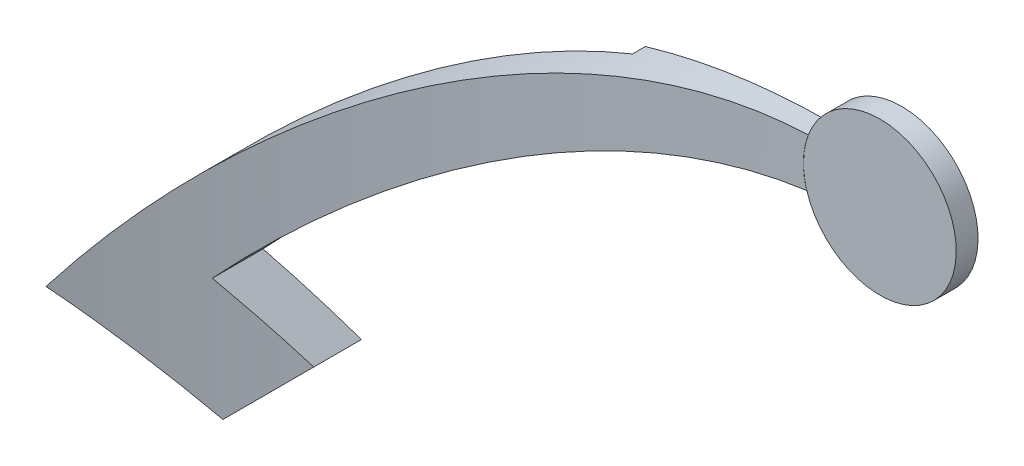
from build123d import *

# Parameters (mm, degrees)
BOSS_EXTRU_2_DEPTH           = 2
BOSS_EXTRU_3_DEPTH           = 45
ENL_V_MAT_EXTRU_3_DEPTH      = 5
ENL_V_MAT_EXTRU_3_DEPTH_BACK = 81.143689392
ENL_V_MAT_EXTRU_4_DEPTH      = 70.76004634


with BuildPart() as part:
    # Esquisse3 → Boss.-Extru.2 (new body)
    with BuildSketch(Plane.XY):
        with BuildLine():
            ThreePointArc((7, 0), (1.246257582, 6.888166813), (-6.556240583, 2.452694319))
            ThreePointArc((-6.556240583, 2.452694319), (-6.99644453, 0.22307834), (-6.699170831, -2.030051767))
            ThreePointArc((-6.699170831, -2.030051767), (1.026110175, -6.924384298), (7, 0))
        make_face()
    extrude(amount=BOSS_EXTRU_2_DEPTH)

    # Esquisse3<3> → Boss.-Extru.3 (add)
    with BuildSketch(Plane.XY):
        with BuildLine():
            ThreePointArc((-6.556240583, 2.452694319), (-35.156121343, -4.82839961), (-56.806558544, -24.883974331))
            Line((-56.806558544, -24.883974331), (-47.470277823, -34.220255052))
            Line((-47.470277823, -34.220255052), (-42.209094679, -28.959071907))
            Line((-42.209094679, -28.959071907), (-48.061618993, -23.106547593))
            ThreePointArc((-48.061618993, -23.106547593), (-29.360618565, -8.682127194), (-6.699170831, -2.030051767))
            ThreePointArc((-6.699170831, -2.030051767), (-6.99644453, 0.22307834), (-6.556240583, 2.452694319))
        make_face()
    extrude(amount=BOSS_EXTRU_3_DEPTH)

    # Esquisse4 → Enlèv. mat.-Extru.3 (cut, two sides: drawn at the far end of the back side and taken through both)
    with BuildSketch(Plane(origin=(0, 0, 0), x_dir=(1, 0, 0), z_dir=(0, 1, 0)).offset(-ENL_V_MAT_EXTRU_3_DEPTH_BACK)):
        with BuildLine():
            Line((-6.556240583, -21.643777245), (-6.556240583, -2))
            ThreePointArc((-6.556240583, -2), (-33.331448935, -7.600933328), (-56.806558544, -21.643777245))
            Line((-56.806558544, -21.643777245), (-56.806558544, -45))
            Line((-56.806558544, -45), (-56.806558544, -53.527020644))
            Line((-56.806558544, -53.527020644), (-6.425184121, -53.527020644))
            Line((-6.425184121, -53.527020644), (-6.556240583, -21.643777245))
        make_face()
    extrude(amount=ENL_V_MAT_EXTRU_3_DEPTH + ENL_V_MAT_EXTRU_3_DEPTH_BACK, mode=Mode.SUBTRACT)

    # Esquisse4<4> → Enlèv. mat.-Extru.4 (cut, through all)
    with BuildSketch(Plane(origin=(0, 0, 0), x_dir=(1, 0, 0), z_dir=(0, 1, 0))):
        with BuildLine():
            ThreePointArc((-56.806558544, -16.643777245), (-36.412027531, -4.815736188), (-13.332856502, 0))
            Line((-13.332856502, 0), (-56.806558544, 0))
            Line((-56.806558544, 0), (-56.806558544, -16.643777245))
        make_face()
    extrude(amount=-ENL_V_MAT_EXTRU_4_DEPTH, mode=Mode.SUBTRACT)


solid = part.part
